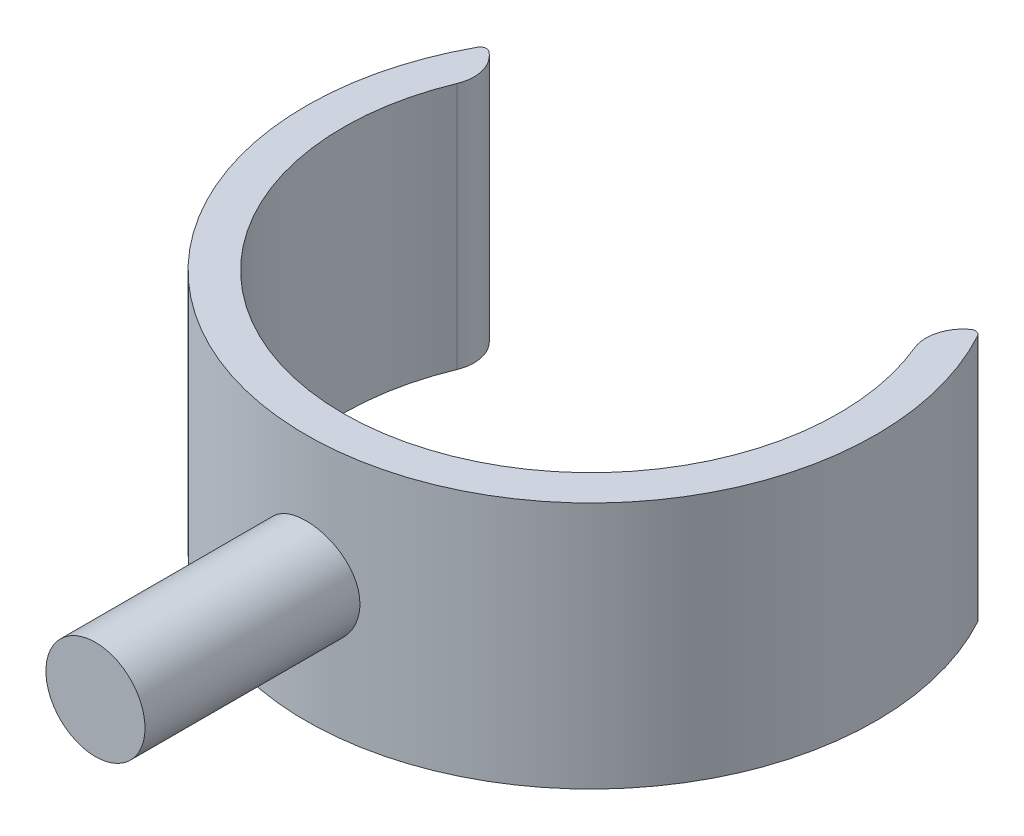
from build123d import *

# Parameters (mm, degrees)
EXTRUIR1_DEPTH      = 20
EXTRUIR2_REACH      = 80.184
EXTRUIR2_END_RADIUS = 23
EXTRUIR2_START      = 40
CROQUIS2_R          = 4
REDONDEO1_R         = 3
REDONDEO2_R         = 0.5


with BuildPart() as part:
    # Croquis1 → Extruir1 (new body)
    with BuildSketch(Plane(origin=(0, 0, 0), x_dir=(1, 0, 0), z_dir=(0, 1, 0))):
        with BuildLine():
            Line((19.918584287, 11.5), (17.320508076, 10))
            ThreePointArc((17.320508076, 10), (0, -20), (-17.320508076, 10))
            Line((-17.320508076, 10), (-19.918584287, 11.5))
            ThreePointArc((-19.918584287, 11.5), (0, -23), (19.918584287, 11.5))
        make_face()
    extrude(amount=EXTRUIR1_DEPTH)

    # Extruir2: up to this cylinder (the profile starts outside it)
    extruir2_end = Plane(origin=(0, 10, 0), z_dir=(0, -1, 0)) * Cylinder(EXTRUIR2_END_RADIUS, 207.368, mode=Mode.PRIVATE)
    # Croquis2 → Extruir2 (add, up to the surface)
    with BuildSketch(Plane.XY.offset(EXTRUIR2_START), mode=Mode.PRIVATE) as extruir2_sk1:
        with Locations((0, 10)):
            Circle(CROQUIS2_R)
    extruir2_tool1 = extrude(extruir2_sk1.sketch, amount=-EXTRUIR2_REACH, mode=Mode.PRIVATE) - extruir2_end
    add(extruir2_tool1.solids().sort_by_distance((0, 10, 40))[0])

    # Redondeo1
    redondeo1_edges = [part.edges().sort_by_distance(p)[0] for p in [
        (17.320508076, 10, -10),
        (-17.320508076, 10, -10),
    ]]
    fillet(redondeo1_edges, radius=REDONDEO1_R)

    # Redondeo2
    redondeo2_edges = [part.edges().sort_by_distance(p)[0] for p in [
        (19.918584287, 10, -11.5),
        (-19.918584287, 10, -11.5),
    ]]
    fillet(redondeo2_edges, radius=REDONDEO2_R)


solid = part.part
